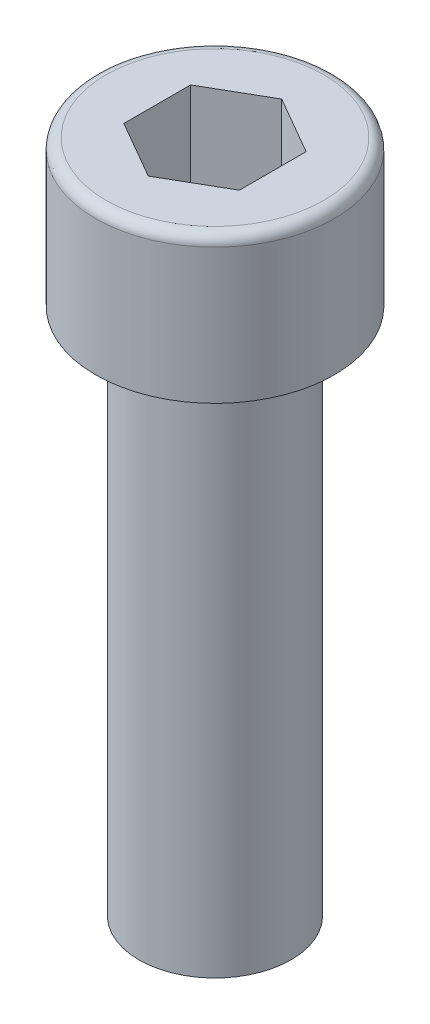
from build123d import *

# Parameters (mm, degrees)
SKETCH1_R           = 1.8288
BOSS_EXTRUDE1_DEPTH = 12.7
SKETCH2_R           = 2.8702
BOSS_EXTRUDE2_DEPTH = 3.5052
FILLET1_R           = 0.254
CUT_EXTRUDE1_DEPTH  = 2.54


with BuildPart() as part:
    # Sketch1 → Boss-Extrude1 (new body)
    with BuildSketch(Plane(origin=(0, 0, 0), x_dir=(1, 0, 0), z_dir=(0, 1, 0))):
        with Locations(Location((0, 0, 0), (0, 0, 270))):
            Circle(SKETCH1_R)
    extrude(amount=-BOSS_EXTRUDE1_DEPTH)

    # Sketch2 → Boss-Extrude2 (add)
    with BuildSketch(Plane(origin=(0, 0, 0), x_dir=(1, 0, 0), z_dir=(0, 1, 0))):
        with Locations(Location((0, 0, 0), (0, 0, 270))):
            Circle(SKETCH2_R)
    extrude(amount=BOSS_EXTRUDE2_DEPTH)

    # Fillet1
    fillet1_edges = [part.edges().sort_by_distance(p)[0] for p in [
        (0, 3.5052, -2.8702),
    ]]
    fillet(fillet1_edges, radius=FILLET1_R)

    # Sketch3 → Cut-Extrude1 (cut)
    with BuildSketch(Plane(origin=(0, 3.5052, 0), x_dir=(1, 0, 0), z_dir=(0, 1, 0))):
        Polygon((0, 1.603951217), (-1.3890625, 0.801975608), (-1.3890625, -0.801975608), (0, -1.603951217), (1.3890625, -0.801975608), (1.3890625, 0.801975608), align=None)
    extrude(amount=-CUT_EXTRUDE1_DEPTH, mode=Mode.SUBTRACT)


solid = part.part
